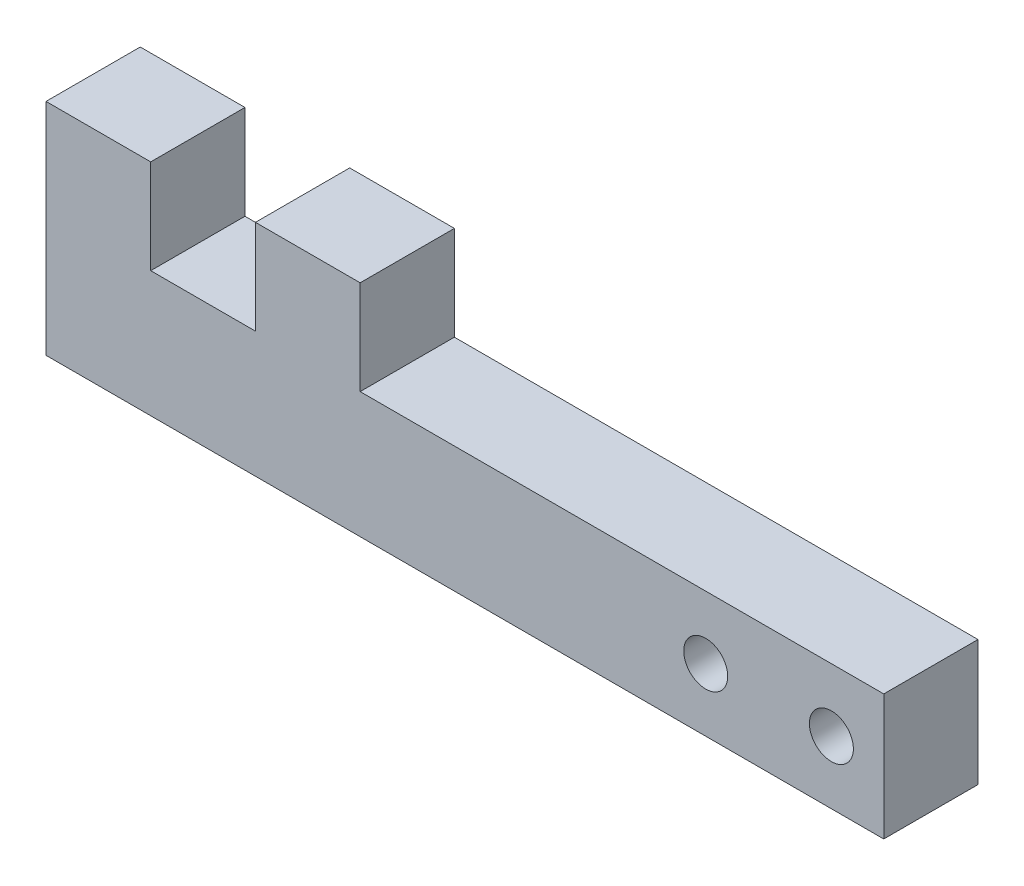
from build123d import *

# Parameters (mm, degrees)
ESQUISSE1_W             = 80
ESQUISSE1_H             = 12
BOSS_EXTRU_1_DEPTH      = 9
ESQUISSE2_W             = 10
ESQUISSE2_H             = 9
BOSS_EXTRU_2_DEPTH      = 9
ESQUISSE3_R             = 2.1
ENL_V_MAT_EXTRU_1_DEPTH = 84.19855768


with BuildPart() as part:
    # Esquisse1 → Boss.-Extru.1 (new body)
    with BuildSketch(Plane.XY):
        with Locations((40, 6)):
            Rectangle(ESQUISSE1_W, ESQUISSE1_H)
    extrude(amount=BOSS_EXTRU_1_DEPTH)

    # Esquisse2 → Boss.-Extru.2 (add)
    with BuildSketch(Plane.XY.offset(9)):
        with Locations((5, 16.5)):
            Rectangle(ESQUISSE2_W, ESQUISSE2_H)
        with Locations((25, 16.5)):
            Rectangle(ESQUISSE2_W, ESQUISSE2_H)
    extrude(amount=-BOSS_EXTRU_2_DEPTH)

    # Esquisse3 → Enlèv. mat.-Extru.1 (cut, through all)
    with BuildSketch(Plane.XY.offset(9)):
        with Locations((63, 6)):
            Circle(ESQUISSE3_R)
        with Locations((75, 6)):
            Circle(ESQUISSE3_R)
    extrude(amount=-ENL_V_MAT_EXTRU_1_DEPTH, mode=Mode.SUBTRACT)


solid = part.part
